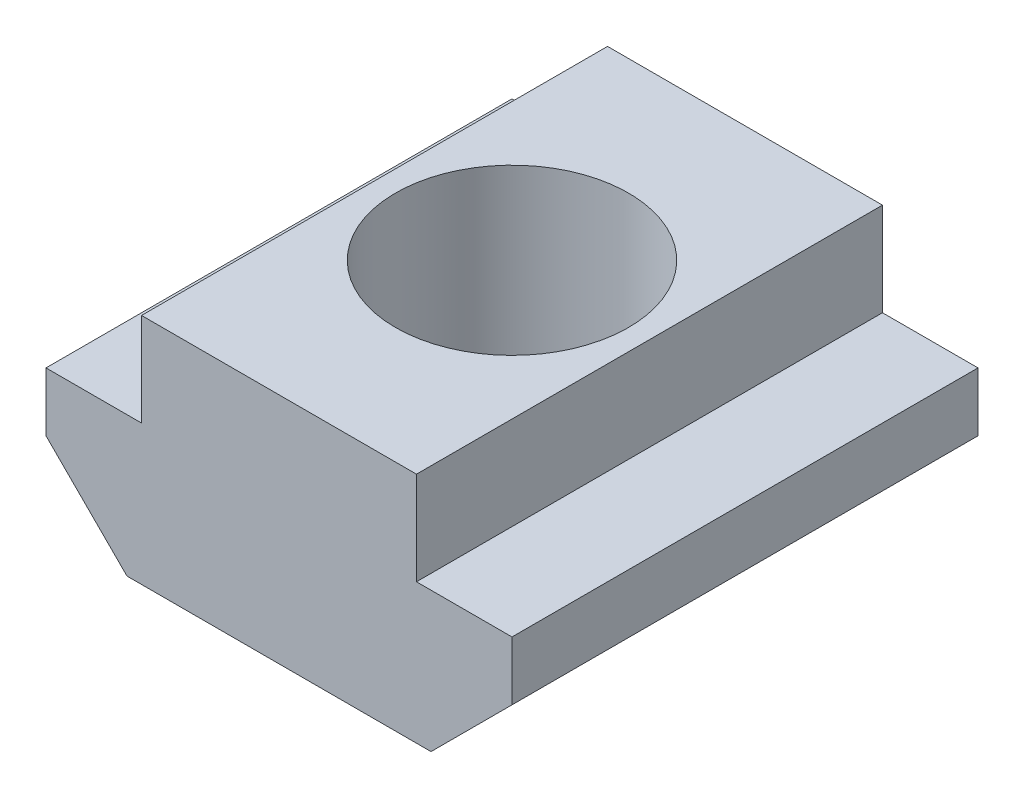
from build123d import *

# Parameters (mm, degrees)
BOSS_EXTRU_1_DEPTH      = 10
ENL_V_MAT_EXTRU_1_REACH = 18.58
ESQUISSE2_R             = 2.5


with BuildPart() as part:
    # Esquisse1 → Boss.-Extru.1 (new body)
    with BuildSketch(Plane.XY):
        Polygon((-10.506087259, -2.086075409), (-3.981368971, -2.086075409), (-2.243728115, -0.348434553), (-2.243728115, 0.913924591), (-4.293728115, 0.913924591), (-4.293728115, 2.913924591), (-10.193728115, 2.913924591), (-10.193728115, 0.913924591), (-12.243728115, 0.913924591), (-12.243728115, -0.348434553), align=None)
    extrude(amount=BOSS_EXTRU_1_DEPTH)

    # Esquisse2 → Enlèv. mat.-Extru.1 (cut, up to next)
    with BuildSketch(Plane(origin=(0, 2.913924591, 0), x_dir=(1, 0, 0), z_dir=(0, 1, 0)), mode=Mode.PRIVATE) as enl_v_mat_extru_1_sk1:
        with Locations(Location((-7.243728115, -5, 0), (0, 0, 270))):
            Circle(ESQUISSE2_R)
    enl_v_mat_extru_1_tool1 = extrude(enl_v_mat_extru_1_sk1.sketch, amount=-ENL_V_MAT_EXTRU_1_REACH, mode=Mode.PRIVATE) & part.part
    add(enl_v_mat_extru_1_tool1.solids().sort_by_distance((-7.243728, 2.913925, 5))[0], mode=Mode.SUBTRACT)


solid = part.part
